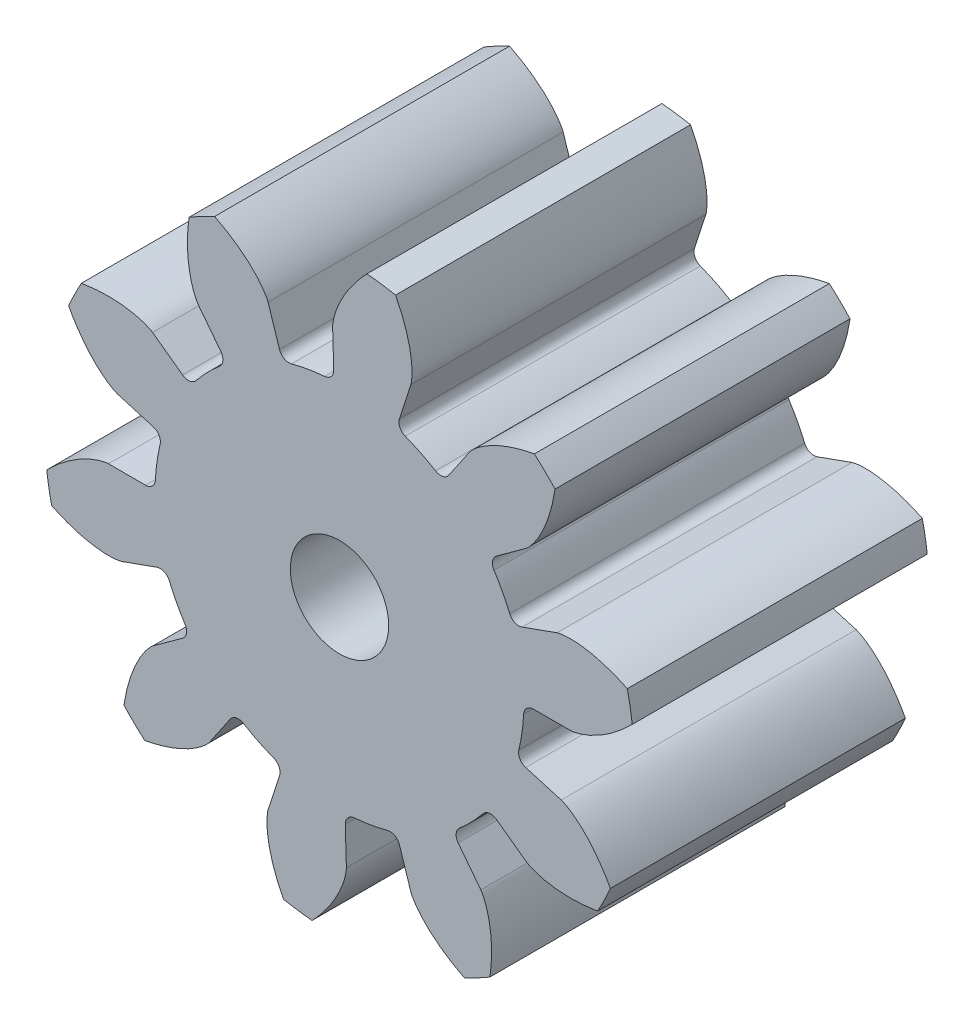
from build123d import *

# Parameters (mm, degrees)
SKETCH1_R                 = 3
SKETCH1_R_2               = 0.5
BOSS_EXTRUDE1_DEPTH       = 3
CUT_EXTRUDE1_DEPTH        = 6.196152423
FILLET1_R                 = 0.1
FILLET2_R                 = 0.1
CIRPATTERN14_COUNT        = 10
FILLET1_OF_CIRPATTERN14_R = 0.1
FILLET2_OF_CIRPATTERN14_R = 0.1


with BuildPart() as part:
    # Sketch1 → Boss-Extrude1 (new body)
    with BuildSketch(Plane.XY):
        Circle(SKETCH1_R)
        Circle(SKETCH1_R_2, mode=Mode.SUBTRACT)
    extrude(amount=BOSS_EXTRUDE1_DEPTH)

    # Sketch3 → Cut-Extrude1 (cut, symmetric)
    with BuildSketch(Plane.XY):
        with BuildLine():
            Line((2.349231552, 0), (1.875, 0))
            ThreePointArc((1.875, 0), (1.856081461, -0.265681404), (1.799707617, -0.526001418))
            Line((1.799707617, -0.526001418), (2.254895957, -0.659039534))
            add(Edge.make_bspline(
                [(2.254895957, -0.659039534), (2.25787422, -0.659964984), (2.263412007, -0.662006003), (2.272335221, -0.665647303), (2.28963445, -0.673621098), (2.308733433, -0.683697496), (2.329817981, -0.696108803), (2.351960539, -0.710461339), (2.37055689, -0.723353992), (2.388782848, -0.736785197), (2.406637626, -0.750674073), (2.427896574, -0.768090276), (2.452866607, -0.78979201), (2.48125934, -0.816322919), (2.512498608, -0.847768154), (2.543262663, -0.881223453), (2.572636886, -0.915287409), (2.60124253, -0.95097608), (2.62815616, -0.986405552), (2.654963624, -1.024453254), (2.679127595, -1.060212821), (2.704887132, -1.10160237), (2.723954513, -1.133176247), (2.741793877, -1.165151948), (2.750857671, -1.181773258), (2.754508482, -1.188563427)],
                knots=[0, 0, 0, 0, 0, 0.015083688, 0.02853182, 0.046610139, 0.092110525, 0.119476176, 0.146842496, 0.174208854, 0.201574956, 0.228941013, 0.256307345, 0.307035032, 0.361767352, 0.41649966, 0.471231936, 0.525964282, 0.580696615, 0.635428982, 0.690161387, 0.744893688, 0.799626082, 0.854358408, 0.894707215, 0.894707215, 0.894707215, 0.894707215, 0.894707215], degree=4))
            ThreePointArc((2.754508482, -1.188563427), (2.937986168, -0.606825573), (3, 0))
            ThreePointArc((3, 0), (2.99432743, 0.184399683), (2.977331171, 0.36810202))
            add(Edge.make_bspline(
                [(2.349231552, 0), (2.35234984, 5.2783e-05), (2.358237828, 0.000458305), (2.367824231, 0.00145012), (2.386665714, 0.004250696), (2.407824532, 0.008564551), (2.431544205, 0.014562535), (2.456823984, 0.022126989), (2.478290409, 0.029285016), (2.499552398, 0.037063875), (2.520586503, 0.045386157), (2.545877617, 0.056139136), (2.575933031, 0.069964472), (2.610628452, 0.087464878), (2.649434739, 0.108883719), (2.688348786, 0.132365224), (2.726099561, 0.156820838), (2.763568407, 0.183051539), (2.799340469, 0.209508117), (2.835745132, 0.238507571), (2.868970554, 0.266052361), (2.905306872, 0.298553446), (2.932466133, 0.323510393), (2.958559414, 0.34919753), (2.971922087, 0.362608693), (2.977331171, 0.36810202)],
                knots=[0, 0, 0, 0, 0, 0.015083688, 0.02853182, 0.046610139, 0.092110525, 0.119476176, 0.146842496, 0.174208854, 0.201574956, 0.228941013, 0.256307345, 0.307035032, 0.361767352, 0.41649966, 0.471231936, 0.525964282, 0.580696615, 0.635428982, 0.690161387, 0.744893688, 0.799626082, 0.854358408, 0.894707215, 0.894707215, 0.894707215, 0.894707215, 0.894707215], degree=4))
        make_face()
    cut_extrude1 = extrude(amount=CUT_EXTRUDE1_DEPTH, both=True, mode=Mode.SUBTRACT)

    # Fillet1
    fillet1_edges = [part.edges().sort_by_distance(p)[0] for p in [
        (1.799707617, -0.526001418, 1.5),
    ]]
    fillet(fillet1_edges, radius=FILLET1_R)

    # Fillet2
    fillet2_edges = [part.edges().sort_by_distance(p)[0] for p in [
        (1.875, 0, 1.5),
    ]]
    fillet(fillet2_edges, radius=FILLET2_R)

    # CirPattern14: Cut-Extrude1 ×10 about axis
    cirpattern14_axis = Axis((0, 0, 3), (0, 0, -1))
    for i in range(1, CIRPATTERN14_COUNT):
        add(cut_extrude1.rotate(cirpattern14_axis, i * 360 / CIRPATTERN14_COUNT), mode=Mode.SUBTRACT)

    # Fillet1 of CirPattern14
    fillet1_of_cirpattern14_edges = [part.edges().sort_by_distance(p)[0] for p in [
        (1.146818171, -1.483385682, 1.5),
        (0.055883163, -1.874167034, 1.5),
        (-1.056397315, -1.54908028, 1.5),
        (-1.765169924, -0.63229751, 1.5),
        (-1.799707617, 0.526001418, 1.5),
        (-1.146818171, 1.483385682, 1.5),
        (-0.055883163, 1.874167034, 1.5),
        (1.056397315, 1.54908028, 1.5),
        (1.765169924, 0.63229751, 1.5),
    ]]
    fillet(fillet1_of_cirpattern14_edges, radius=FILLET1_OF_CIRPATTERN14_R)

    # Fillet2 of CirPattern14
    fillet2_of_cirpattern14_edges = [part.edges().sort_by_distance(p)[0] for p in [
        (1.516906864, -1.102097348, 1.5),
        (0.579406864, -1.783230968, 1.5),
        (-0.579406864, -1.783230968, 1.5),
        (-1.516906864, -1.102097348, 1.5),
        (-1.875, 0, 1.5),
        (-1.516906864, 1.102097348, 1.5),
        (-0.579406864, 1.783230968, 1.5),
        (0.579406864, 1.783230968, 1.5),
        (1.516906864, 1.102097348, 1.5),
    ]]
    fillet(fillet2_of_cirpattern14_edges, radius=FILLET2_OF_CIRPATTERN14_R)


solid = part.part
